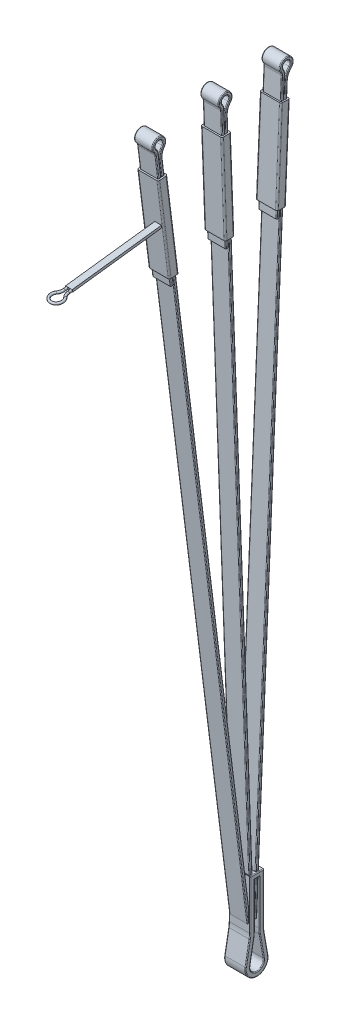
from build123d import *

# Parameters (mm, degrees)
CIRPATTERN1_COUNT        = 2
CIRPATTERN1_ANGLE        = 355.4
CIRPATTERN2_COUNT        = 2
CIRPATTERN2_ANGLE        = 350.4
BOSS_EXTRUDE2_DEPTH      = 1
BOSS_EXTRUDE2_DEPTH_BACK = 5
SKETCH9_W                = 14
SKETCH9_H                = 60
FILLET1_R                = 1
CIRPATTERN3_COUNT        = 2
CIRPATTERN3_ANGLE        = 355.4
CIRPATTERN4_COUNT        = 2
CIRPATTERN4_ANGLE        = 350.4
SKETCH10_W               = 4.3519854
SKETCH10_H               = 1.609638436
BOSS_EXTRUDE4_DEPTH      = 60
SKETCH12_R               = 0.761355503


with BuildPart() as part:
    # Sweep2: sweep along a path in Sketch7
    with BuildLine(Plane(origin=(0, 0, 0), x_dir=(0, 0, -1), z_dir=(1, 0, 0))) as sweep2_path:
        Line((3, 50), (3, 19.288550711))
        ThreePointArc((3, 19.288550711), (3.076106038, 17.545435856), (3.30384494, 15.815587157))
        Line((3.30384494, 15.815587157), (5.908846518, 1.041889066))
        ThreePointArc((5.908846518, 1.041889066), (0, -6), (-5.908846518, 1.041889066))
        Line((-5.908846518, 1.041889066), (-3.30384494, 15.815587157))
        ThreePointArc((-3.30384494, 15.815587157), (-3.076106038, 17.545435856), (-3, 19.288550711))
        Line((-3, 19.288550711), (-3, 50))
        Line((-3, 50), (3, 50))
    # Sketch8 → Sweep2 (sweep)
    with BuildSketch(Plane(origin=(0, 50, -3), x_dir=(1, 0, 0), z_dir=(0, -1, 0))):
        with BuildLine():
            Line((-6.5, 1.5), (6.5, 1.5))
            ThreePointArc((6.5, 1.5), (6.853553391, 1.353553391), (7, 1))
            Line((7, 1), (7, -1))
            ThreePointArc((7, -1), (6.853553391, -1.353553391), (6.5, -1.5))
            Line((6.5, -1.5), (-6.5, -1.5))
            ThreePointArc((-6.5, -1.5), (-6.853553391, -1.353553391), (-7, -1))
            Line((-7, -1), (-7, 1))
            ThreePointArc((-7, 1), (-6.853553391, 1.353553391), (-6.5, 1.5))
        make_face()
    sweep(path=sweep2_path.line, transition=Transition.RIGHT)

    # Sweep1: sweep along a path in Sketch3
    with BuildLine(Plane(origin=(0, 0, 0), x_dir=(0, 0, -1), z_dir=(1, 0, 0))) as sweep1_path:
        Line((0, 25), (20.119435025, 490.518400161))
        ThreePointArc((20.119435025, 490.518400161), (20.944907886, 494.086496271), (22.999683012, 497.118098896))
        ThreePointArc((22.999683012, 497.118098896), (20.824751441, 503.065032191), (17.622969386, 497.601980422))
        ThreePointArc((17.622969386, 497.601980422), (18.168135768, 496.442270079), (18.318593398, 495.1696755))
        Line((18.318593398, 495.1696755), (14.861039838, 415.1696755))
    # Sketch5 → Sweep1 (sweep)
    with BuildSketch(Plane(origin=(0, 415.1696755, -14.861039838), x_dir=(1, 0, 0), z_dir=(0, -0.99906734727479, 0.04317911079809595))):
        with BuildLine():
            Line((-5.5, 1), (5.5, 1))
            ThreePointArc((5.5, 1), (5.853553391, 0.853553391), (6, 0.5))
            Line((6, 0.5), (6, -0.5))
            ThreePointArc((6, -0.5), (5.853553391, -0.853553391), (5.5, -1))
            Line((5.5, -1), (-5.5, -1))
            ThreePointArc((-5.5, -1), (-5.853553391, -0.853553391), (-6, -0.5))
            Line((-6, -0.5), (-6, 0.5))
            ThreePointArc((-6, 0.5), (-5.853553391, 0.853553391), (-5.5, 1))
        make_face()
    sweep1 = sweep(path=sweep1_path.line)

    # CirPattern1: Sweep1 ×2 about axis
    cirpattern1_axis = Axis((0, 0, 0), (-1, 0, 0))
    for i in range(1, CIRPATTERN1_COUNT):
        add(sweep1.rotate(cirpattern1_axis, i * CIRPATTERN1_ANGLE / (CIRPATTERN1_COUNT - 1)))

    # CirPattern2: Sweep1 ×2 about axis
    cirpattern2_axis = Axis((0, 0, 0), (-1, 0, 0))
    for i in range(1, CIRPATTERN2_COUNT):
        add(sweep1.rotate(cirpattern2_axis, i * CIRPATTERN2_ANGLE / (CIRPATTERN2_COUNT - 1)))


with BuildPart() as body_2:
    # Sketch9 → Boss-Extrude2 (new, two sides: drawn at the far end of the back side and taken through both)
    with BuildSketch(Plane(origin=(0, 0.003431779, 0.079403645), x_dir=(-1, 0, 0), z_dir=(0, -0.04317911079809587, -0.99906734727479)).offset(-BOSS_EXTRUDE2_DEPTH_BACK)):
        with Locations((0, 450.929656153)):
            Rectangle(SKETCH9_W, SKETCH9_H)
    extrude(amount=BOSS_EXTRUDE2_DEPTH + BOSS_EXTRUDE2_DEPTH_BACK)

    # Fillet1
    fillet1_edges = [body_2.edges().sort_by_distance(p)[0] for p in [
        (-7, 450.728422714, -14.396001204),
        (7, 450.469348049, -20.390405288),
        (-7, 450.469348049, -20.390405288),
        (7, 450.728422714, -14.396001204),
    ]]
    fillet(fillet1_edges, radius=FILLET1_R)


with BuildPart() as cirpattern3_1:
    # CirPattern3: pattern copy
    add(body_2.part.rotate(Axis((0, 0, 0), (-1, 0, 0)), 1 * CIRPATTERN3_ANGLE / (CIRPATTERN3_COUNT - 1)))


with BuildPart() as cirpattern4_1:
    # CirPattern4: pattern copy
    add(body_2.part.rotate(Axis((0, 0, 0), (-1, 0, 0)), 1 * CIRPATTERN4_ANGLE / (CIRPATTERN4_COUNT - 1)))


with BuildPart() as body_5:
    # Sketch10 → Boss-Extrude4 (new body)
    with BuildSketch(Plane(origin=(0, -0.506013434, 4.047973478), x_dir=(1, 0, 0), z_dir=(0, -0.12403877725883326, 0.9922773713716007))):
        with Locations((3.430929835, 452.630933894)):
            Rectangle(SKETCH10_W, SKETCH10_H)
    extrude(amount=BOSS_EXTRUDE4_DEPTH)

    # Sweep3: sweep along a path in Sketch11
    with BuildLine(Plane(origin=(0, 449.934037184, 56.243616381), x_dir=(1, 0, 0), z_dir=(0, 0.9922773713716007, 0.12403877725883326))) as sweep3_path:
        Line((1.992431767, -64.07947777), (1.992431767, -65.955488416))
        ThreePointArc((1.992431767, -65.955488416), (1.634986141, -67.81201444), (0.613756216, -69.403097621))
        ThreePointArc((0.613756216, -69.403097621), (3.522628944, -76.161167542), (6.391533993, -69.386034081))
        ThreePointArc((6.391533993, -69.386034081), (5.355380502, -67.787324197), (4.992431767, -65.91709545))
        Line((4.992431767, -65.91709545), (4.992431767, -64.07947777))
    # Sketch12 → Sweep3 (sweep)
    with BuildSketch(Plane(origin=(0, -7.94834007, 63.58461576), x_dir=(1, 0, 0), z_dir=(0, -0.12403877725883548, 0.9922773713716004))):
        with Locations((2.056804857, 452.627063563)):
            Circle(SKETCH12_R)
    sweep(path=sweep3_path.line)


solid = Compound([part.part, body_2.part, cirpattern3_1.part, cirpattern4_1.part, body_5.part])
